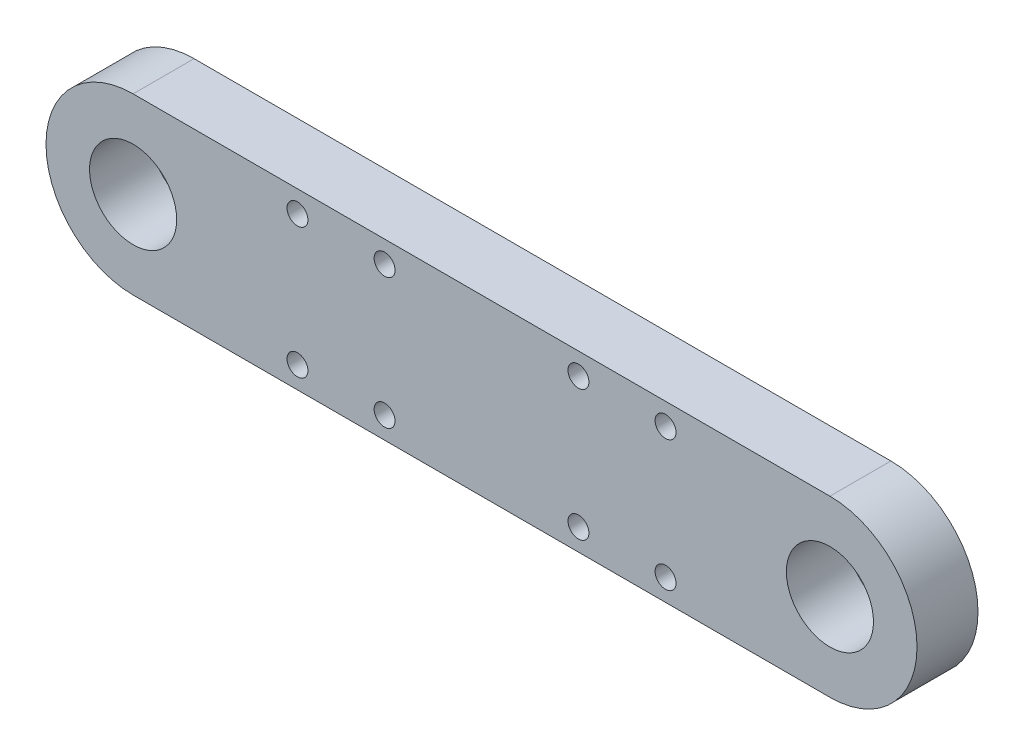
from build123d import *

# Parameters (mm, degrees)
SKETCH_1_R          = 10
SKETCH_1_R_2        = 5
EXTRUDE_1_DEPTH     = 7
SKETCH_2_R          = 1.2
CUT_EXTRUDE_1_DEPTH = 10
CUT_EXTRUDE_START   = -10
SKETCH_3_R          = 5
CUT_EXTRUDE_2_DEPTH = 10
SKETCH_4_R          = 1.2
CUT_EXTRUDE_3_DEPTH = 10


with BuildPart() as part:
    # 草图1 → 凸台-拉伸1 (new body)
    # profile 1 of 2: a face of its own
    with BuildSketch(Plane.XY):
        Circle(SKETCH_1_R)
        Circle(SKETCH_1_R_2, mode=Mode.SUBTRACT)
    # profile 2 of 2: a face of its own
    with BuildSketch(Plane.XY):
        with BuildLine():
            Line((80, 10), (0, 10))
            ThreePointArc((0, 10), (7.071067812, 7.071067812), (10, 0))
            ThreePointArc((10, 0), (7.071067812, -7.071067812), (0, -10))
            Line((0, -10), (80, -10))
            ThreePointArc((80, -10), (90, 0), (80, 10))
        make_face()
    extrude(amount=EXTRUDE_1_DEPTH)

    # 草图2 → 切除-拉伸1 (cut)
    with BuildSketch(Plane(origin=(0, 0, 0), x_dir=(-1, 0, 0), z_dir=(0, 0, -1))):
        with Locations((-51.129038153, -7.5)):
            Circle(SKETCH_2_R)
        with Locations((-61.129038153, -7.5)):
            Circle(SKETCH_2_R)
        with Locations((-61.129038153, 7.5)):
            Circle(SKETCH_2_R)
        with Locations((-51.129038153, 7.5)):
            Circle(SKETCH_2_R)
    extrude(amount=-CUT_EXTRUDE_1_DEPTH, mode=Mode.SUBTRACT)

    # 草图3 → 切除-拉伸2 (cut)
    with BuildSketch(Plane.XY.offset(7).offset(CUT_EXTRUDE_START)):
        Circle(SKETCH_3_R)
        with Locations((80, 0)):
            Circle(SKETCH_3_R)
    extrude(amount=CUT_EXTRUDE_2_DEPTH, mode=Mode.SUBTRACT)

    # 草图4 → 切除-拉伸3 (cut)
    with BuildSketch(Plane.XY.offset(7).offset(CUT_EXTRUDE_START)):
        with Locations(Location((61.129038153, 7.5, 0), (0, 0, 180))):
            Circle(SKETCH_4_R)
        with Locations(Location((61.129038153, -7.5, 0), (0, 0, 180))):
            Circle(SKETCH_4_R)
        with Locations(Location((51.129038153, -7.5, 0), (0, 0, 180))):
            Circle(SKETCH_4_R)
        with Locations(Location((51.129038153, 7.5, 0), (0, 0, 180))):
            Circle(SKETCH_4_R)
        with Locations((28.870961847, 7.5)):
            Circle(SKETCH_4_R)
        with Locations((28.870961847, -7.5)):
            Circle(SKETCH_4_R)
        with Locations((18.870961847, -7.5)):
            Circle(SKETCH_4_R)
        with Locations((18.870961847, 7.5)):
            Circle(SKETCH_4_R)
    extrude(amount=CUT_EXTRUDE_3_DEPTH, mode=Mode.SUBTRACT)


solid = part.part
